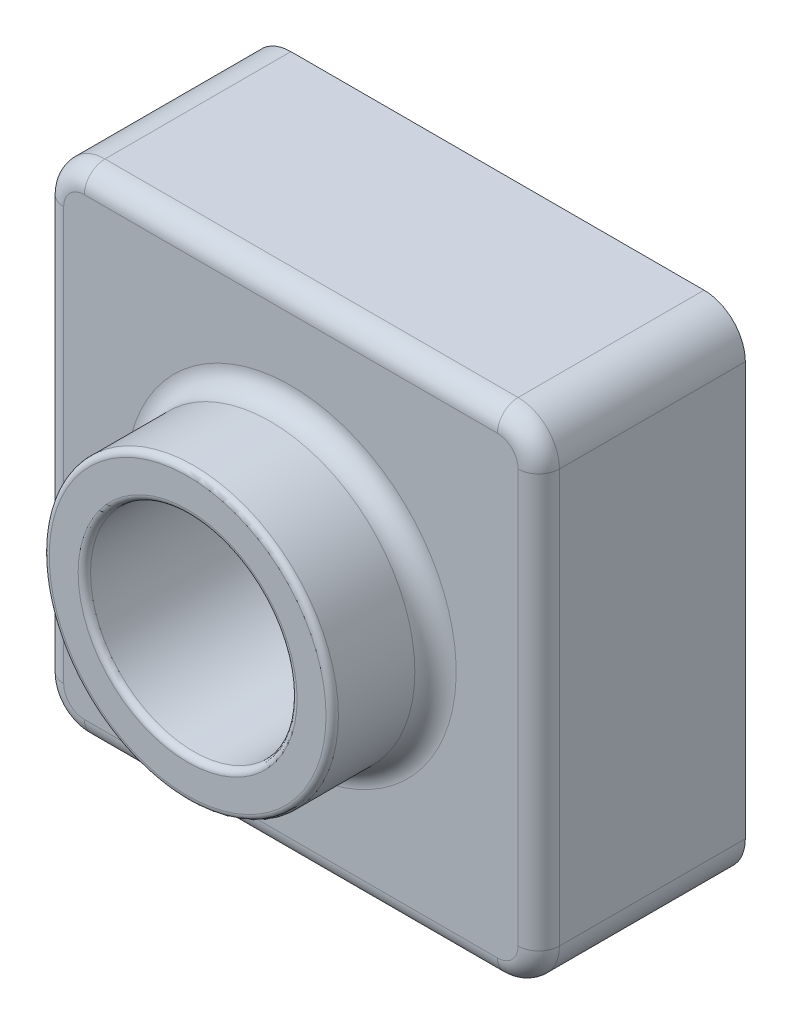
from build123d import *

# Parameters (mm, degrees)
SKETCH1_W           = 120
SKETCH1_H           = 120
BOSS_EXTRUDE1_DEPTH = 50
SKETCH3_R           = 35
BOSS_EXTRUDE3_DEPTH = 25
SKETCH4_R           = 25
CUT_EXTRUDE1_DEPTH  = 186.539753153
FILLET1_R           = 10
FILLET2_R           = 1.5
FILLET3_R           = 5
SHELL1_T            = -2


with BuildPart() as part:
    # Sketch1 → Boss-Extrude1 (new body)
    with BuildSketch(Plane.XY):
        with Locations((60, 60)):
            Rectangle(SKETCH1_W, SKETCH1_H)
    extrude(amount=BOSS_EXTRUDE1_DEPTH)

    # Sketch3 → Boss-Extrude3 (add)
    with BuildSketch(Plane.XY.offset(50)):
        with Locations((60, 60)):
            Circle(SKETCH3_R)
    extrude(amount=BOSS_EXTRUDE3_DEPTH)

    # Sketch4 → Cut-Extrude1 (cut, through all)
    with BuildSketch(Plane.XY.offset(75)):
        with Locations((60, 60)):
            Circle(SKETCH4_R)
    extrude(amount=-CUT_EXTRUDE1_DEPTH, mode=Mode.SUBTRACT)

    # Fillet1
    fillet1_edges = [part.edges().sort_by_distance(p)[0] for p in [
        (0, 120, 25),
        (120, 120, 25),
        (120, 0, 25),
        (0, 0, 25),
    ]]
    fillet(fillet1_edges, radius=FILLET1_R)

    # Fillet2
    fillet2_edges = [part.edges().sort_by_distance(p)[0] for p in [
        (25, 60, 75),
        (35, 60, 75),
    ]]
    fillet(fillet2_edges, radius=FILLET2_R)

    # Fillet3
    fillet3_edges = [part.edges().sort_by_distance(p)[0] for p in [
        (25, 60, 50),
        (60, 0, 50),
        (0, 60, 50),
        (120, 60, 50),
        (60, 120, 50),
        (117.071067812, 117.071067812, 50),
        (2.928932188, 117.071067812, 50),
        (117.071067812, 2.928932188, 50),
        (2.928932188, 2.928932188, 50),
    ]]
    fillet(fillet3_edges, radius=FILLET3_R)

    # Shell1
    shell1_openings = [part.faces().sort_by_distance(p)[0] for p in [
        (60, 1.697056275, 0),
    ]]
    offset(amount=SHELL1_T, openings=shell1_openings, kind=Kind.INTERSECTION)


solid = part.part
